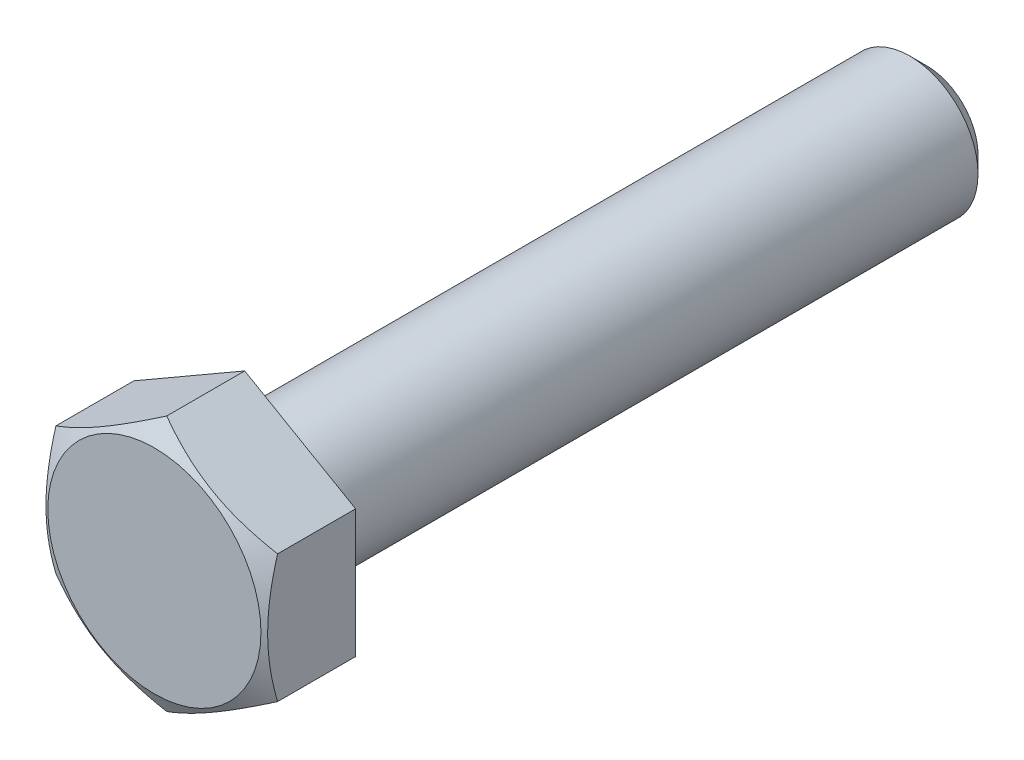
from build123d import *

# Parameters (mm, degrees)
EXTRUDE_1_DEPTH     = 5.3
SKETCH_2_OUTSIDE_W  = 61.562
SKETCH_2_OUTSIDE_H  = 63.574
SKETCH_2_OUTSIDE_R  = 6.25
CUT_EXTRUDE_1_DEPTH = 12.254924848
CUT_EXTRUDE_1_DRAFT = -60
SKETCH_3_R          = 4
EXTRUDE_2_DEPTH     = 40
CHAMFER_1_SIZE      = 1
FILLET_1_R          = 0.5


with BuildPart() as part:
    # Эскиз1 → Бобышка-Вытянуть1 (new body)
    with BuildSketch(Plane.XY):
        Polygon((0, 7.505553499), (-6.5, 3.75277675), (-6.5, -3.75277675), (0, -7.505553499), (6.5, -3.75277675), (6.5, 3.75277675), align=None)
    extrude(amount=EXTRUDE_1_DEPTH)


with BuildPart() as cut_extrude_1_tool:
    # Эскиз2 outside → Вырез-Вытянуть1 (with draft: the straight prism first)
    with BuildSketch(Plane.XY.offset(5.3)):
        Rectangle(SKETCH_2_OUTSIDE_W, SKETCH_2_OUTSIDE_H)
        Circle(SKETCH_2_OUTSIDE_R, mode=Mode.SUBTRACT)
    extrude(amount=-CUT_EXTRUDE_1_DEPTH)
    # Вырез-Вытянуть1: the draft: its side faces are tilted about the plane it starts from
    cut_extrude_1_sides = [cut_extrude_1_tool.faces().sort_by_distance(p)[0] for p in [
        (0, -31.787, -0.827462424),
        (30.781, 0, -0.827462424),
        (0, 31.787, -0.827462424),
        (-30.781, 0, -0.827462424),
        (-6.25, 0, -0.827462424),
    ]]
    draft(cut_extrude_1_sides, Plane.XY.offset(5.3), CUT_EXTRUDE_1_DRAFT)


with BuildPart() as part_1:
    add(part.part)

    # Вырез-Вытянуть1: cut by cut_extrude_1_tool
    add(cut_extrude_1_tool.part, mode=Mode.SUBTRACT)

    # Эскиз3 → Бобышка-Вытянуть2 (add)
    with BuildSketch(Plane(origin=(0, 0, 0), x_dir=(-1, 0, 0), z_dir=(0, 0, -1))):
        with Locations(Location((0, 0, 0), (0, 0, 180))):
            Circle(SKETCH_3_R)
    extrude(amount=EXTRUDE_2_DEPTH)

    # Фаска1
    chamfer_1_edges = [part_1.edges().sort_by_distance(p)[0] for p in [
        (-4, 0, -40),
    ]]
    chamfer(chamfer_1_edges, length=CHAMFER_1_SIZE)

    # Скругление1
    fillet_1_edges = [part_1.edges().sort_by_distance(p)[0] for p in [
        (-4, 0, 0),
    ]]
    fillet(fillet_1_edges, radius=FILLET_1_R)


solid = part_1.part
